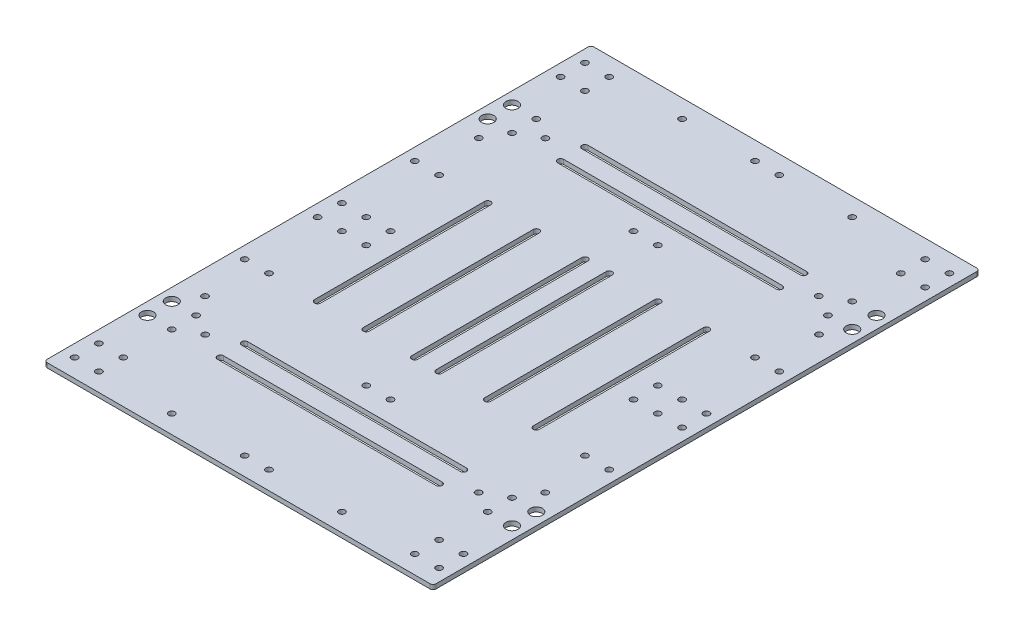
from build123d import *

# Parameters (mm, degrees)
SKETCH1_W           = 256
SKETCH1_H           = 360
BOSS_EXTRUDE1_DEPTH = 3
FILLET1_R           = 2
SKETCH2_R           = 4
CUT_EXTRUDE2_DEPTH  = 221.89137602
SKETCH4_R           = 2.05
CUT_EXTRUDE3_DEPTH  = 221.89137602
SKETCH5_R           = 2.05
CUT_EXTRUDE4_DEPTH  = 221.89137602
CUT_EXTRUDE5_DEPTH  = 221.89137602


with BuildPart() as part:
    # Sketch1 → Boss-Extrude1 (new body)
    with BuildSketch(Plane(origin=(0, 0, 0), x_dir=(1, 0, 0), z_dir=(0, 1, 0))):
        Rectangle(SKETCH1_W, SKETCH1_H)
    extrude(amount=-BOSS_EXTRUDE1_DEPTH)

    # Fillet1
    fillet1_edges = [part.edges().sort_by_distance(p)[0] for p in [
        (-128, -1.5, -180),
        (128, -1.5, -180),
        (128, -1.5, 180),
        (-128, -1.5, 180),
    ]]
    fillet(fillet1_edges, radius=FILLET1_R)

    # Sketch2 → Cut-Extrude2 (cut, through all)
    with BuildSketch(Plane(origin=(0, 0, 0), x_dir=(1, 0, 0), z_dir=(0, 1, 0))):
        with Locations(Location((-120, 104, 0), (0, 0, 270))):
            Circle(SKETCH2_R)
        with Locations(Location((-120, 120, 0), (0, 0, 270))):
            Circle(SKETCH2_R)
        with Locations(Location((120, 104, 0), (0, 0, 90))):
            Circle(SKETCH2_R)
        with Locations(Location((120, 120, 0), (0, 0, 90))):
            Circle(SKETCH2_R)
        with Locations(Location((120, -104, 0), (0, 0, 270))):
            Circle(SKETCH2_R)
        with Locations(Location((120, -120, 0), (0, 0, 270))):
            Circle(SKETCH2_R)
        with Locations(Location((-120, -120, 0), (0, 0, 90))):
            Circle(SKETCH2_R)
        with Locations(Location((-120, -104, 0), (0, 0, 90))):
            Circle(SKETCH2_R)
    extrude(amount=-CUT_EXTRUDE2_DEPTH, mode=Mode.SUBTRACT)

    # Sketch4 → Cut-Extrude3 (cut, through all)
    with BuildSketch(Plane(origin=(0, 0, 0), x_dir=(1, 0, 0), z_dir=(0, 1, 0))):
        with Locations(Location((-120, 168, 0), (0, 0, 270))):
            Circle(SKETCH4_R)
        with Locations(Location((-104, 168, 0), (0, 0, 270))):
            Circle(SKETCH4_R)
        with Locations(Location((-56, 168, 0), (0, 0, 270))):
            Circle(SKETCH4_R)
        with Locations(Location((-8, 168, 0), (0, 0, 270))):
            Circle(SKETCH4_R)
        with Locations(Location((-104, 152, 0), (0, 0, 270))):
            Circle(SKETCH4_R)
        with Locations(Location((-104, 120, 0), (0, 0, 270))):
            Circle(SKETCH4_R)
        with Locations(Location((-104, 104, 0), (0, 0, 270))):
            Circle(SKETCH4_R)
        with Locations(Location((-8, 88, 0), (0, 0, 270))):
            Circle(SKETCH4_R)
        with Locations(Location((-104, 56, 0), (0, 0, 270))):
            Circle(SKETCH4_R)
        with Locations(Location((-104, 8, 0), (0, 0, 270))):
            Circle(SKETCH4_R)
        with Locations(Location((-88, 8, 0), (0, 0, 270))):
            Circle(SKETCH4_R)
        with Locations(Location((-120, 152, 0), (0, 0, 270))):
            Circle(SKETCH4_R)
        with Locations((-120, 120)):
            Circle(SKETCH4_R)
        with Locations((-120, 104)):
            Circle(SKETCH4_R)
        with Locations(Location((-120, 56, 0), (0, 0, 270))):
            Circle(SKETCH4_R)
        with Locations(Location((-120, 8, 0), (0, 0, 270))):
            Circle(SKETCH4_R)
        with Locations(Location((120, 8, 0), (0, 0, 90))):
            Circle(SKETCH4_R)
        with Locations(Location((120, 56, 0), (0, 0, 90))):
            Circle(SKETCH4_R)
        with Locations((120, 104)):
            Circle(SKETCH4_R)
        with Locations((120, 120)):
            Circle(SKETCH4_R)
        with Locations(Location((120, 152, 0), (0, 0, 90))):
            Circle(SKETCH4_R)
        with Locations(Location((88, 8, 0), (0, 0, 90))):
            Circle(SKETCH4_R)
        with Locations(Location((104, 8, 0), (0, 0, 90))):
            Circle(SKETCH4_R)
        with Locations(Location((104, 56, 0), (0, 0, 90))):
            Circle(SKETCH4_R)
        with Locations(Location((8, 88, 0), (0, 0, 90))):
            Circle(SKETCH4_R)
        with Locations(Location((104, 104, 0), (0, 0, 90))):
            Circle(SKETCH4_R)
        with Locations(Location((104, 120, 0), (0, 0, 90))):
            Circle(SKETCH4_R)
        with Locations(Location((104, 152, 0), (0, 0, 90))):
            Circle(SKETCH4_R)
        with Locations(Location((8, 168, 0), (0, 0, 90))):
            Circle(SKETCH4_R)
        with Locations(Location((56, 168, 0), (0, 0, 90))):
            Circle(SKETCH4_R)
        with Locations(Location((104, 168, 0), (0, 0, 90))):
            Circle(SKETCH4_R)
        with Locations(Location((120, 168, 0), (0, 0, 90))):
            Circle(SKETCH4_R)
        with Locations(Location((120, -168, 0), (0, 0, 270))):
            Circle(SKETCH4_R)
        with Locations(Location((104, -168, 0), (0, 0, 270))):
            Circle(SKETCH4_R)
        with Locations(Location((56, -168, 0), (0, 0, 270))):
            Circle(SKETCH4_R)
        with Locations(Location((8, -168, 0), (0, 0, 270))):
            Circle(SKETCH4_R)
        with Locations(Location((104, -152, 0), (0, 0, 270))):
            Circle(SKETCH4_R)
        with Locations(Location((104, -120, 0), (0, 0, 270))):
            Circle(SKETCH4_R)
        with Locations(Location((104, -104, 0), (0, 0, 270))):
            Circle(SKETCH4_R)
        with Locations(Location((8, -88, 0), (0, 0, 270))):
            Circle(SKETCH4_R)
        with Locations(Location((104, -56, 0), (0, 0, 270))):
            Circle(SKETCH4_R)
        with Locations(Location((104, -8, 0), (0, 0, 270))):
            Circle(SKETCH4_R)
        with Locations(Location((88, -8, 0), (0, 0, 270))):
            Circle(SKETCH4_R)
        with Locations(Location((120, -152, 0), (0, 0, 270))):
            Circle(SKETCH4_R)
        with Locations((120, -120)):
            Circle(SKETCH4_R)
        with Locations((120, -104)):
            Circle(SKETCH4_R)
        with Locations(Location((120, -56, 0), (0, 0, 270))):
            Circle(SKETCH4_R)
        with Locations(Location((120, -8, 0), (0, 0, 270))):
            Circle(SKETCH4_R)
        with Locations(Location((-120, -8, 0), (0, 0, 90))):
            Circle(SKETCH4_R)
        with Locations(Location((-120, -56, 0), (0, 0, 90))):
            Circle(SKETCH4_R)
        with Locations((-120, -104)):
            Circle(SKETCH4_R)
        with Locations((-120, -120)):
            Circle(SKETCH4_R)
        with Locations(Location((-120, -152, 0), (0, 0, 90))):
            Circle(SKETCH4_R)
        with Locations(Location((-88, -8, 0), (0, 0, 90))):
            Circle(SKETCH4_R)
        with Locations(Location((-104, -8, 0), (0, 0, 90))):
            Circle(SKETCH4_R)
        with Locations(Location((-104, -56, 0), (0, 0, 90))):
            Circle(SKETCH4_R)
        with Locations(Location((-8, -88, 0), (0, 0, 90))):
            Circle(SKETCH4_R)
        with Locations(Location((-104, -104, 0), (0, 0, 90))):
            Circle(SKETCH4_R)
        with Locations(Location((-104, -120, 0), (0, 0, 90))):
            Circle(SKETCH4_R)
        with Locations(Location((-104, -152, 0), (0, 0, 90))):
            Circle(SKETCH4_R)
        with Locations(Location((-8, -168, 0), (0, 0, 90))):
            Circle(SKETCH4_R)
        with Locations(Location((-56, -168, 0), (0, 0, 90))):
            Circle(SKETCH4_R)
        with Locations(Location((-104, -168, 0), (0, 0, 90))):
            Circle(SKETCH4_R)
        with Locations(Location((-120, -168, 0), (0, 0, 90))):
            Circle(SKETCH4_R)
    extrude(amount=-CUT_EXTRUDE3_DEPTH, mode=Mode.SUBTRACT)

    # Sketch5 → Cut-Extrude4 (cut, through all)
    with BuildSketch(Plane(origin=(0, 0, 0), x_dir=(1, 0, 0), z_dir=(0, 1, 0))):
        with Locations(Location((-112, 90.15, 0), (0, 0, 270))):
            Circle(SKETCH5_R)
        with Locations(Location((-90, 112, 0), (0, 0, 270))):
            Circle(SKETCH5_R)
        with Locations(Location((112, 90.15, 0), (0, 0, 90))):
            Circle(SKETCH5_R)
        with Locations(Location((90, 112, 0), (0, 0, 90))):
            Circle(SKETCH5_R)
        with Locations(Location((112, -90.15, 0), (0, 0, 270))):
            Circle(SKETCH5_R)
        with Locations(Location((90, -112, 0), (0, 0, 270))):
            Circle(SKETCH5_R)
        with Locations(Location((-90, -112, 0), (0, 0, 90))):
            Circle(SKETCH5_R)
        with Locations(Location((-112, -90.15, 0), (0, 0, 90))):
            Circle(SKETCH5_R)
    extrude(amount=-CUT_EXTRUDE4_DEPTH, mode=Mode.SUBTRACT)

    # Sketch6 → Cut-Extrude5 (cut, through all)
    with BuildSketch(Plane(origin=(0, 0, 0), x_dir=(1, 0, 0), z_dir=(0, 1, 0))):
        with BuildLine():
            Line((-72, 122), (72, 122))
            ThreePointArc((72, 122), (74, 120), (72, 118))
            Line((72, 118), (-72, 118))
            ThreePointArc((-72, 118), (-74, 120), (-72, 122))
        make_face()
        with BuildLine():
            Line((-72, 106), (72, 106))
            ThreePointArc((72, 106), (74, 104), (72, 102))
            Line((72, 102), (-72, 102))
            ThreePointArc((-72, 102), (-74, 104), (-72, 106))
        make_face()
        with BuildLine():
            Line((-10, -56), (-10, 56))
            ThreePointArc((-10, 56), (-8, 58), (-6, 56))
            Line((-6, 56), (-6, -56))
            ThreePointArc((-6, -56), (-8, -58), (-10, -56))
        make_face()
        with BuildLine():
            Line((-42, -56), (-42, 56))
            ThreePointArc((-42, 56), (-40, 58), (-38, 56))
            Line((-38, 56), (-38, -56))
            ThreePointArc((-38, -56), (-40, -58), (-42, -56))
        make_face()
        with BuildLine():
            Line((-74, -56), (-74, 56))
            ThreePointArc((-74, 56), (-72, 58), (-70, 56))
            Line((-70, 56), (-70, -56))
            ThreePointArc((-70, -56), (-72, -58), (-74, -56))
        make_face()
        with BuildLine():
            Line((-72, -106), (72, -106))
            ThreePointArc((72, -106), (74, -104), (72, -102))
            Line((72, -102), (-72, -102))
            ThreePointArc((-72, -102), (-74, -104), (-72, -106))
        make_face()
        with BuildLine():
            Line((-72, -122), (72, -122))
            ThreePointArc((72, -122), (74, -120), (72, -118))
            Line((72, -118), (-72, -118))
            ThreePointArc((-72, -118), (-74, -120), (-72, -122))
        make_face()
        with BuildLine():
            Line((74, -56), (74, 56))
            ThreePointArc((74, 56), (72, 58), (70, 56))
            Line((70, 56), (70, -56))
            ThreePointArc((70, -56), (72, -58), (74, -56))
        make_face()
        with BuildLine():
            Line((42, -56), (42, 56))
            ThreePointArc((42, 56), (40, 58), (38, 56))
            Line((38, 56), (38, -56))
            ThreePointArc((38, -56), (40, -58), (42, -56))
        make_face()
        with BuildLine():
            Line((10, -56), (10, 56))
            ThreePointArc((10, 56), (8, 58), (6, 56))
            Line((6, 56), (6, -56))
            ThreePointArc((6, -56), (8, -58), (10, -56))
        make_face()
    extrude(amount=-CUT_EXTRUDE5_DEPTH, mode=Mode.SUBTRACT)


solid = part.part
